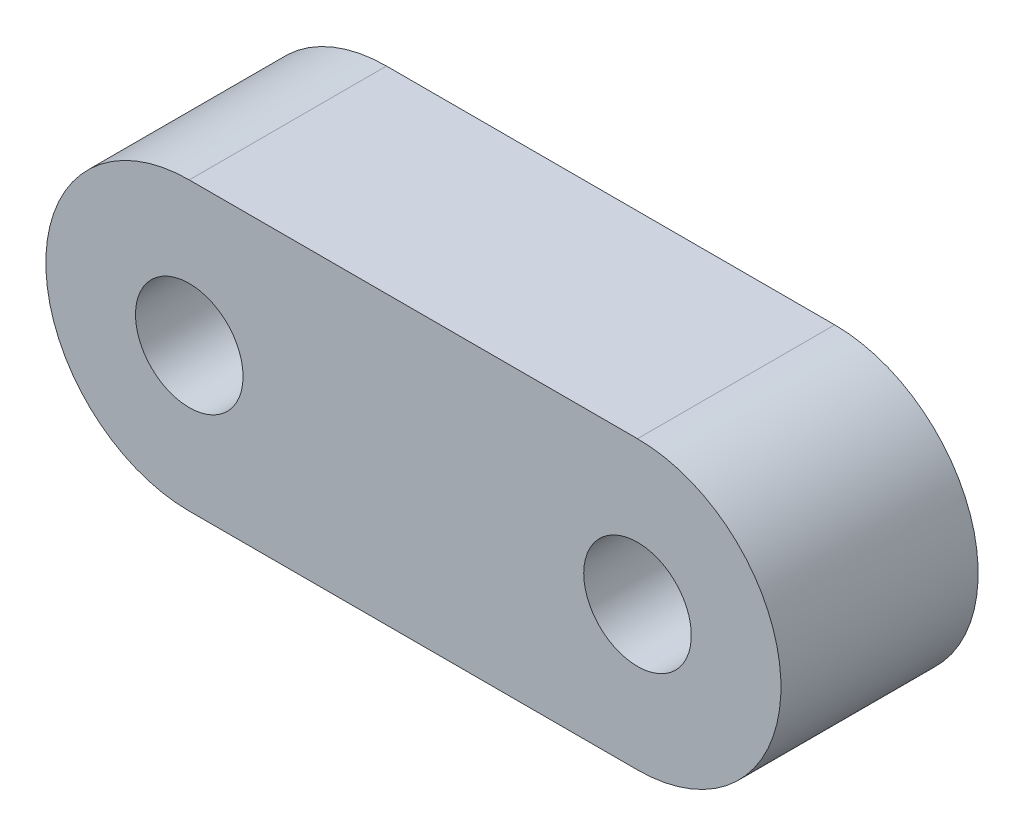
from build123d import *

# Parameters (mm, degrees)
SKETCH_1_R      = 1.5
EXTRUDE_1_DEPTH = 5.5


with BuildPart() as part:
    # ｽｹｯﾁ1 → ﾎﾞｽ - 押し出し1 (new body)
    with BuildSketch(Plane.XY):
        with BuildLine():
            Line((0, 4), (12.5, 4))
            ThreePointArc((12.5, 4), (16.5, 0), (12.5, -4))
            Line((12.5, -4), (0, -4))
            ThreePointArc((0, -4), (-4, 0), (0, 4))
        make_face()
        Circle(SKETCH_1_R, mode=Mode.SUBTRACT)
        with Locations(Location((12.5, 0, 0), (0, 0, 180))):
            Circle(SKETCH_1_R, mode=Mode.SUBTRACT)
    extrude(amount=EXTRUDE_1_DEPTH)


solid = part.part
